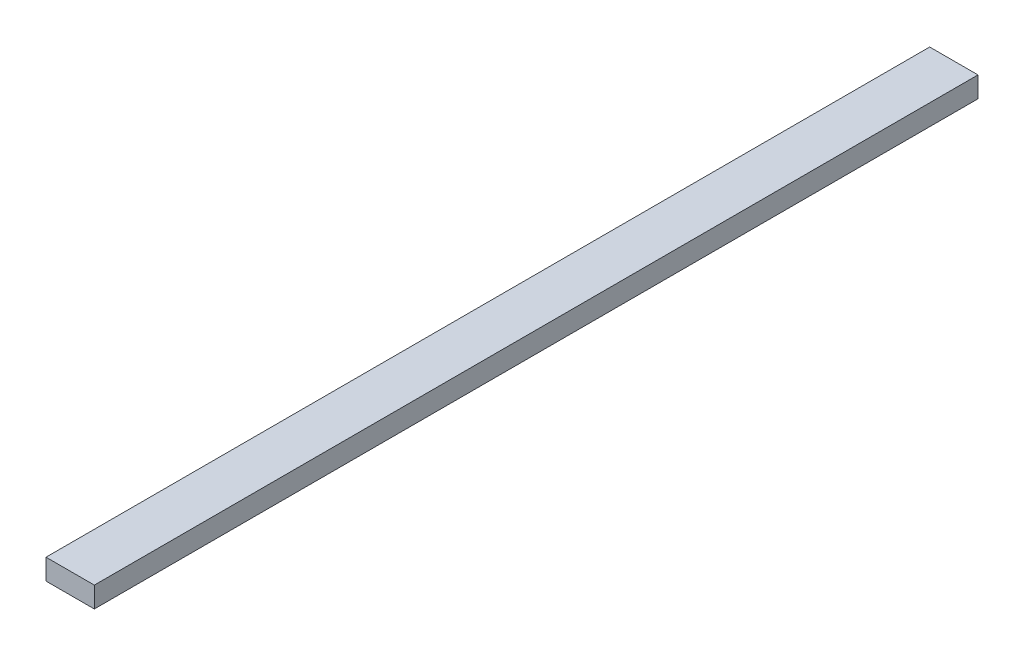
from build123d import *

# Parameters (mm, degrees)
SKETCH1_W           = 88.9
SKETCH1_H           = 38.1
BOSS_EXTRUDE1_DEPTH = 1625.6


with BuildPart() as part:
    # Sketch1 → Boss-Extrude1 (new body)
    with BuildSketch(Plane.XY):
        with Locations((44.45, -19.05)):
            Rectangle(SKETCH1_W, SKETCH1_H)
    extrude(amount=BOSS_EXTRUDE1_DEPTH)


solid = part.part
